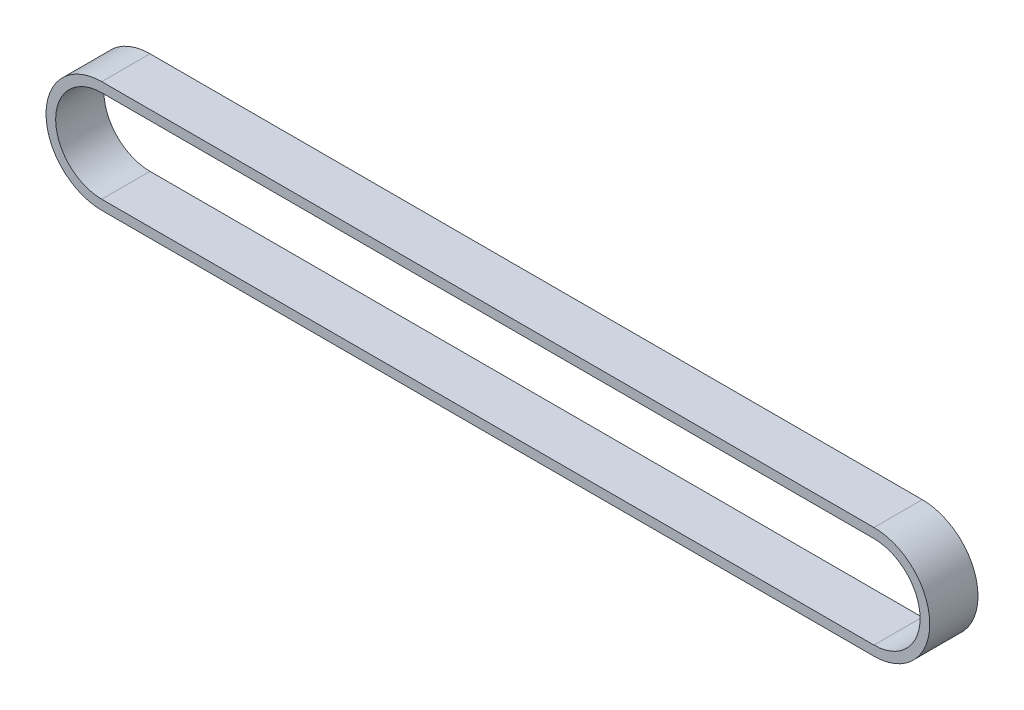
from build123d import *

# Parameters (mm, degrees)
EXTRUDE_THIN1_DEPTH = 7.5


with BuildPart() as part:
    # Sketch2 → Extrude-Thin1 (new, symmetric)
    with BuildSketch(Plane.XY):
        with BuildLine():
            Line((239.996685237, -17.325), (0, -17.325))
            ThreePointArc((0, -17.325), (-17.325, 0), (0, 17.325))
            Line((0, 17.325), (239.996685237, 17.325))
            ThreePointArc((239.996685237, 17.325), (257.321685237, 0), (239.996685237, -17.325))
        make_face()
        with BuildLine():
            Line((239.996685237, -14.325), (0, -14.325))
            ThreePointArc((0, -14.325), (-14.325, 0), (0, 14.325))
            Line((0, 14.325), (239.996685237, 14.325))
            ThreePointArc((239.996685237, 14.325), (254.321685237, 0), (239.996685237, -14.325))
        make_face(mode=Mode.SUBTRACT)
    extrude(amount=EXTRUDE_THIN1_DEPTH, both=True)


solid = part.part
